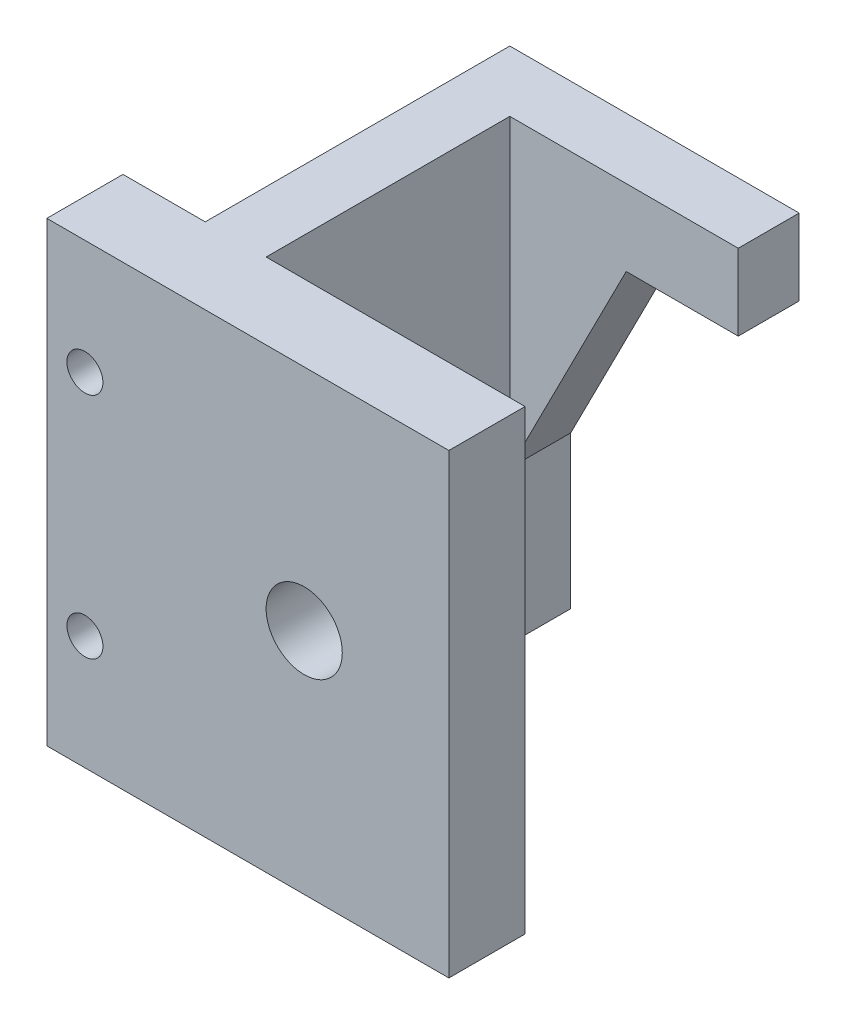
from build123d import *

# Parameters (mm, degrees)
SKETCH2_W           = 6.35
SKETCH2_H           = 38.1
BOSS_EXTRUDE1_DEPTH = 19.05
SKETCH3_R           = 1.5
CUT_EXTRUDE1_DEPTH  = 28.679008291
SKETCH4_W           = 14.478
SKETCH4_H           = 6.35
SKETCH4_W_2         = 9.525
SKETCH4_H_2         = 5.08
BOSS_EXTRUDE2_DEPTH = 38.1
SKETCH5_R           = 3.175
CUT_EXTRUDE2_DEPTH  = 6.35
CUT_EXTRUDE3_DEPTH  = 5.08
BOSS_EXTRUDE3_DEPTH = 5.08


with BuildPart() as part:
    # Sketch2 → Boss-Extrude1 (new body)
    with BuildSketch(Plane(origin=(0, 0, 0), x_dir=(0, 0, -1), z_dir=(1, 0, 0))):
        Rectangle(SKETCH2_W, SKETCH2_H)
    extrude(amount=BOSS_EXTRUDE1_DEPTH)

    # Sketch3 → Cut-Extrude1 (cut, through all)
    with BuildSketch(Plane.XY.offset(3.175)):
        with Locations((3.175, 9.525)):
            Circle(SKETCH3_R)
        with Locations((3.175, -9.525)):
            Circle(SKETCH3_R)
    extrude(amount=-CUT_EXTRUDE1_DEPTH, mode=Mode.SUBTRACT)

    # Sketch4 → Boss-Extrude2 (add)
    with BuildSketch(Plane(origin=(0, 19.05, 0), x_dir=(1, 0, 0), z_dir=(0, 1, 0))):
        with Locations((26.289, 0)):
            Rectangle(SKETCH4_W, SKETCH4_H)
        Polygon((6.858, 3.175), (6.858, -3.175), (19.05, -3.175), (19.05, 3.175), (11.938, 3.175), align=None)
        Polygon((6.858, 28.575), (6.858, 3.175), (11.938, 3.175), (11.938, 23.495), (11.938, 28.575), align=None)
        with Locations((16.7005, 26.035)):
            Rectangle(SKETCH4_W_2, SKETCH4_H_2)
    extrude(amount=-BOSS_EXTRUDE2_DEPTH)

    # Sketch5 → Cut-Extrude2 (cut)
    with BuildSketch(Plane.XY.offset(3.175)):
        with Locations((21.463, 0)):
            Circle(SKETCH5_R)
    extrude(amount=-CUT_EXTRUDE2_DEPTH, mode=Mode.SUBTRACT)

    # Sketch6 → Cut-Extrude3 (cut)
    with BuildSketch(Plane(origin=(0, 0, -28.575), x_dir=(-1, 0, 0), z_dir=(0, 0, -1))):
        Polygon((-21.463, -19.05), (-11.938, -19.05), (-11.938, -6.35), (-21.463, 12.343865065), align=None)
    extrude(amount=-CUT_EXTRUDE3_DEPTH, mode=Mode.SUBTRACT)

    # Sketch6<3> → Boss-Extrude3 (add)
    with BuildSketch(Plane(origin=(0, 0, -28.575), x_dir=(-1, 0, 0), z_dir=(0, 0, -1))):
        Polygon((-21.463, 12.343865065), (-21.463, 19.05), (-30.988, 19.05), (-30.988, 12.7), (-21.644459813, 12.7), align=None)
    extrude(amount=-BOSS_EXTRUDE3_DEPTH)


solid = part.part
